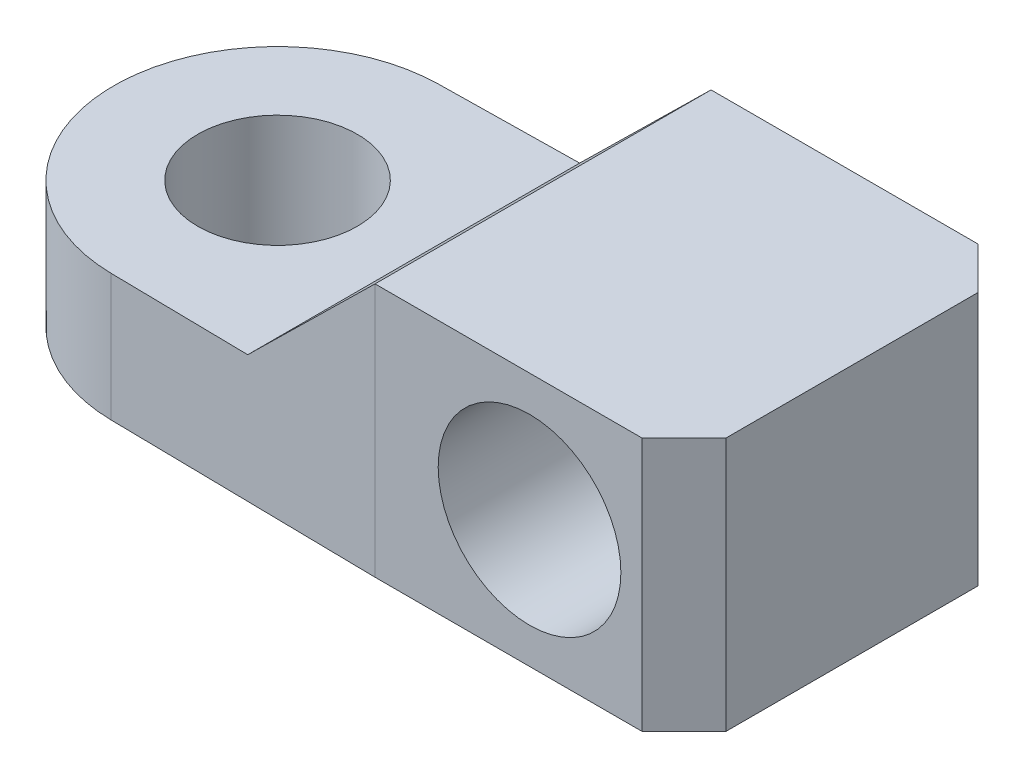
from build123d import *

# Parameters (mm, degrees)
SKETCH1_R               = 1.9
BOSS_EXTRUDE1_DEPTH     = 6.05
CUT_EXTRUDE1_DEPTH      = 19
CUT_EXTRUDE1_DEPTH_BACK = 21
SKETCH2_R               = 2.175
CHAMFER2_SIZE           = 1
CUT_EXTRUDE2_DEPTH      = 10
CUT_EXTRUDE2_DEPTH_BACK = 10


with BuildPart() as part:
    # Sketch1 → Boss-Extrude1 (new body)
    with BuildSketch(Plane(origin=(0, 0, 0), x_dir=(1, 0, 0), z_dir=(0, 1, 0))):
        with BuildLine():
            Line((-0.061383878, 3.899516896), (6.321978872, 4))
            Line((6.321978872, 4), (13.678021128, 4))
            Line((13.678021128, 4), (13.678021128, -4))
            Line((13.678021128, -4), (6.321978872, -4))
            Line((6.321978872, -4), (-0.061383878, -3.899516896))
            ThreePointArc((-0.061383878, -3.899516896), (-3.9, 0), (-0.061383878, 3.899516896))
        make_face()
        with Locations(Location((0, 0, 0), (0, 0, 270))):
            Circle(SKETCH1_R, mode=Mode.SUBTRACT)
    extrude(amount=BOSS_EXTRUDE1_DEPTH)

    # Sketch2 → Cut-Extrude1 (cut, two sides: drawn at the far end of the back side and taken through both)
    with BuildSketch(Plane.XY.offset(-CUT_EXTRUDE1_DEPTH_BACK)):
        with Locations(Location((10, 3.025, 0), (0, 0, 180))):
            Circle(SKETCH2_R)
    extrude(amount=CUT_EXTRUDE1_DEPTH + CUT_EXTRUDE1_DEPTH_BACK, mode=Mode.SUBTRACT)

    # Chamfer2
    chamfer2_edges = [part.edges().sort_by_distance(p)[0] for p in [
        (13.678021128, 3.025, -4),
        (13.678021128, 3.025, 4),
    ]]
    chamfer(chamfer2_edges, length=CHAMFER2_SIZE)

    # Sketch3 → Cut-Extrude2 (cut, two sides: drawn at the far end of the back side and taken through both)
    with BuildSketch(Plane.XY.offset(-CUT_EXTRUDE2_DEPTH_BACK)):
        Polygon((-3.9, 3.025), (3.241860159, 3.025), (6.321978872, 6.05), (-3.9, 6.05), align=None)
    extrude(amount=CUT_EXTRUDE2_DEPTH + CUT_EXTRUDE2_DEPTH_BACK, mode=Mode.SUBTRACT)


solid = part.part
